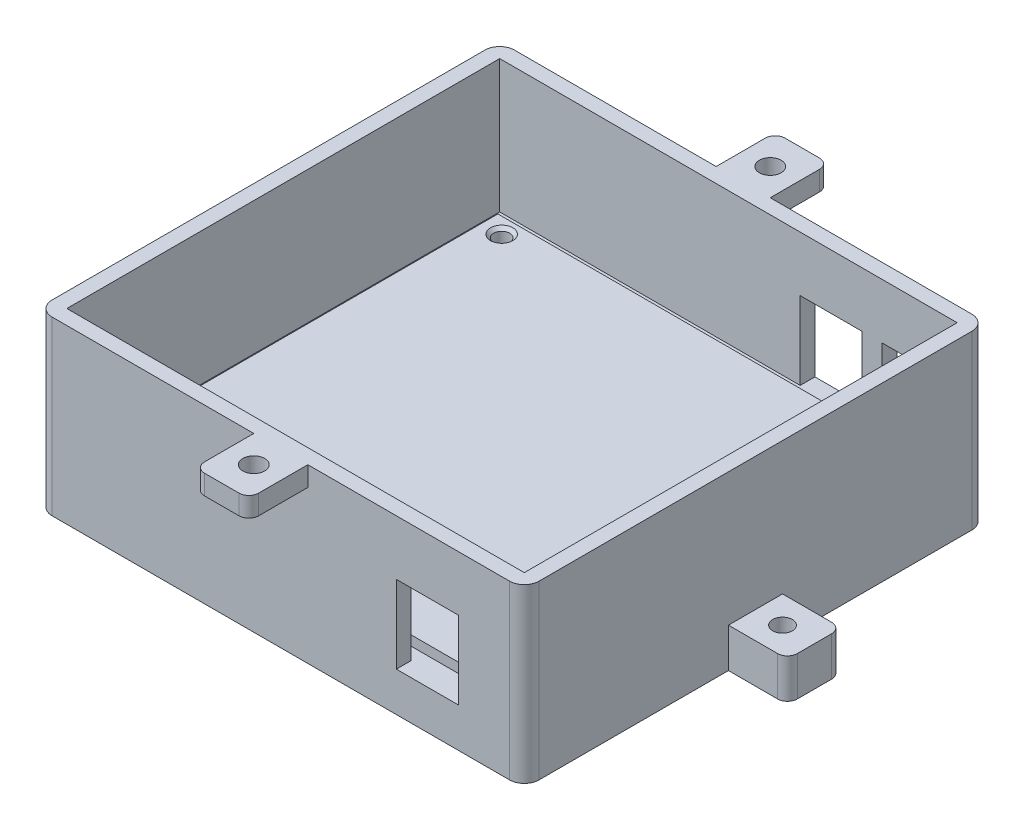
from build123d import *

# Parameters (mm, degrees)
ESBO_O1_W                        = 93
ESBO_O1_H                        = 88
RESSALTO_EXTRUS_O2_DEPTH         = 35
ESBO_O1_5_W                      = 93
ESBO_O1_5_H                      = 88
RESSALTO_EXTRUS_O3_DEPTH         = 8
ESBO_O1_7_R                      = 2
RESSALTO_EXTRUS_O6_DEPTH         = 8
ESBO_O4_R                        = 2.218632056
RESSALTO_EXTRUS_O7_DEPTH         = 4
ESBO_O5_W                        = 88.65
ESBO_O5_H                        = 82.92
RESSALTO_EXTRUS_O8_DEPTH         = 2
ESBO_O7_W                        = 12.6
ESBO_O7_H                        = 15.81
CORTE_EXTRUS_O1_DEPTH            = 154.290573748
ESBO_O8_W                        = 12.6
ESBO_O8_H                        = 15.81
CORTE_EXTRUS_O2_DEPTH            = 154.290573748
FURO_COM_FOLGA_DE_41_D           = 3.2639
FURO_COM_FOLGA_DE_41_DEPTH       = 8
FURO_COM_FOLGA_DE_41_CSINK_D     = 4.5339
FURO_COM_FOLGA_DE_41_CSINK_ANGLE = 90
FURO_COM_FOLGA_DE_41_TIP         = 0.980574487


with BuildPart() as part:
    # Esboço1 → Ressalto-extrusão2 (new body)
    with BuildSketch(Plane(origin=(0, 0, 0), x_dir=(1, 0, 0), z_dir=(0, 1, 0))):
        with BuildLine():
            ThreePointArc((-3, 0), (-2.121320344, -2.121320344), (0, -3))
            Line((0, -3), (93, -3))
            ThreePointArc((93, -3), (95.121320344, -2.121320344), (96, 0))
            Line((96, 0), (96, 38.5))
            Line((96, 38.5), (96, 49.5))
            Line((96, 49.5), (96, 88))
            ThreePointArc((96, 88), (95.121320344, 90.121320344), (93, 91))
            Line((93, 91), (0, 91))
            ThreePointArc((0, 91), (-2.121320344, 90.121320344), (-3, 88))
            Line((-3, 88), (-3, 49.5))
            Line((-3, 49.5), (-3, 38.5))
            Line((-3, 38.5), (-3, 0))
        make_face()
        with Locations((46.5, 44)):
            Rectangle(ESBO_O1_W, ESBO_O1_H, mode=Mode.SUBTRACT)
    extrude(amount=RESSALTO_EXTRUS_O2_DEPTH)

    # Esboço1<5> → Ressalto-extrusão3 (add)
    with BuildSketch(Plane(origin=(0, 0, 0), x_dir=(1, 0, 0), z_dir=(0, 1, 0))):
        with Locations((46.5, 44)):
            Rectangle(ESBO_O1_5_W, ESBO_O1_5_H)
    extrude(amount=RESSALTO_EXTRUS_O3_DEPTH)

    # Esboço1<7> → Ressalto-extrusão6 (add)
    # profile 1 of 2: a face of its own
    with BuildSketch(Plane(origin=(0, 0, 0), x_dir=(1, 0, 0), z_dir=(0, 1, 0))):
        with BuildLine():
            Line((-13, 38.5), (-3, 38.5))
            Line((-3, 38.5), (-3, 49.5))
            Line((-3, 49.5), (-13, 49.5))
            ThreePointArc((-13, 49.5), (-14.414213562, 48.914213562), (-15, 47.5))
            Line((-15, 47.5), (-15, 40.5))
            ThreePointArc((-15, 40.5), (-14.414213562, 39.085786438), (-13, 38.5))
        make_face()
        with Locations((-8.5, 44)):
            Circle(ESBO_O1_7_R, mode=Mode.SUBTRACT)
    # profile 2 of 2: a face of its own
    with BuildSketch(Plane(origin=(0, 0, 0), x_dir=(1, 0, 0), z_dir=(0, 1, 0))):
        with BuildLine():
            Line((96, 49.5), (96, 38.5))
            Line((96, 38.5), (106, 38.5))
            ThreePointArc((106, 38.5), (107.414213562, 39.085786438), (108, 40.5))
            Line((108, 40.5), (108, 47.5))
            ThreePointArc((108, 47.5), (107.414213562, 48.914213562), (106, 49.5))
            Line((106, 49.5), (96, 49.5))
        make_face()
        with Locations((101.5, 44)):
            Circle(ESBO_O1_7_R, mode=Mode.SUBTRACT)
    extrude(amount=RESSALTO_EXTRUS_O6_DEPTH)

    # Esboço4 → Ressalto-extrusão7 (add)
    # profile 1 of 2: a face of its own
    with BuildSketch(Plane(origin=(0, 35, 0), x_dir=(1, 0, 0), z_dir=(0, 1, 0))):
        with BuildLine():
            Line((41, -3), (52, -3))
            Line((52, -3), (52, -13))
            ThreePointArc((52, -13), (51.414213562, -14.414213562), (50, -15))
            Line((50, -15), (43, -15))
            ThreePointArc((43, -15), (41.585786438, -14.414213562), (41, -13))
            Line((41, -13), (41, -3))
        make_face()
        with Locations((46.5, -8.5)):
            Circle(ESBO_O4_R, mode=Mode.SUBTRACT)
    # profile 2 of 2: a face of its own
    with BuildSketch(Plane(origin=(0, 35, 0), x_dir=(1, 0, 0), z_dir=(0, 1, 0))):
        with BuildLine():
            Line((43, 103), (50, 103))
            ThreePointArc((50, 103), (51.414213562, 102.414213562), (52, 101))
            Line((52, 101), (52, 91))
            Line((52, 91), (41, 91))
            Line((41, 91), (41, 101))
            ThreePointArc((41, 101), (41.585786438, 102.414213562), (43, 103))
        make_face()
        with Locations((46.5, 96.5)):
            Circle(ESBO_O4_R, mode=Mode.SUBTRACT)
    extrude(amount=-RESSALTO_EXTRUS_O7_DEPTH)

    # Esboço5 → Ressalto-extrusão8 (add)
    with BuildSketch(Plane(origin=(0, 8, 0), x_dir=(1, 0, 0), z_dir=(0, 1, 0))):
        with Locations((46.5, 44)):
            Rectangle(ESBO_O5_W, ESBO_O5_H)
    extrude(amount=RESSALTO_EXTRUS_O8_DEPTH)

    # Esboço7 → Corte-extrusão1 (cut, through all)
    with BuildSketch(Plane.XY.offset(-88)):
        with Locations((67.38, 15.905)):
            Rectangle(ESBO_O7_W, ESBO_O7_H)
        with Locations((84.02, 15.905)):
            Rectangle(ESBO_O7_W, ESBO_O7_H)
    extrude(amount=-CORTE_EXTRUS_O1_DEPTH, mode=Mode.SUBTRACT)

    # Esboço8 → Corte-extrusão2 (cut, through all)
    with BuildSketch(Plane(origin=(0, 0, 0), x_dir=(-1, 0, 0), z_dir=(0, 0, -1))):
        with Locations((-76.29, 15.905)):
            Rectangle(ESBO_O8_W, ESBO_O8_H)
    extrude(amount=-CORTE_EXTRUS_O2_DEPTH, mode=Mode.SUBTRACT)

    # Furo com folga de #41
    with Locations(Plane(origin=(6.12, 10, -82.28), x_dir=(0, 0, 1), z_dir=(0, 1, 0))):
        with Locations((0, 0), (76.45, 0), (76.45, 80.77)):
            CounterSinkHole(FURO_COM_FOLGA_DE_41_D / 2, FURO_COM_FOLGA_DE_41_CSINK_D / 2, depth=FURO_COM_FOLGA_DE_41_DEPTH, counter_sink_angle=FURO_COM_FOLGA_DE_41_CSINK_ANGLE)
            with Locations((0, 0, -(FURO_COM_FOLGA_DE_41_DEPTH + FURO_COM_FOLGA_DE_41_TIP / 2))):  # 118° drill point
                Cone(0, FURO_COM_FOLGA_DE_41_D / 2, FURO_COM_FOLGA_DE_41_TIP, mode=Mode.SUBTRACT)


solid = part.part
